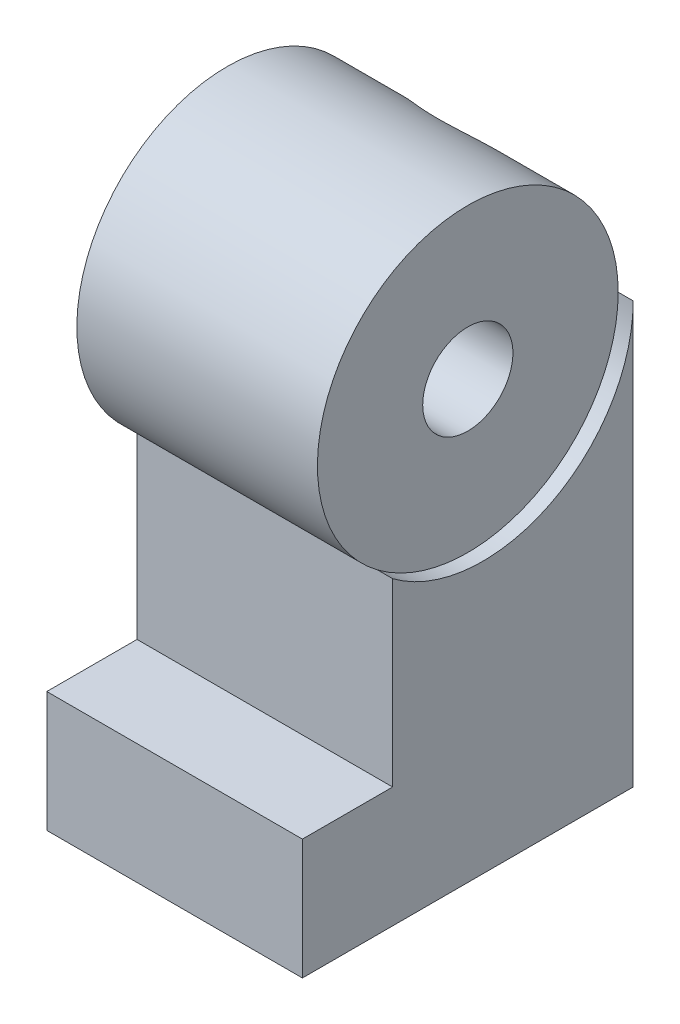
from build123d import *

# Parameters (mm, degrees)
BOSS_EXTRUDE4_DEPTH  = 6.746875
SKETCH6_R            = 3.96875
BOSS_EXTRUDE5_DEPTH  = 6.746875
SHELL2_T             = -0.79375
BOSS_EXTRUDE6_REACH  = 19.089
CUT_EXTRUDE2_START   = -0.396875
SKETCH11_R           = 3.96875
CUT_EXTRUDE2_DEPTH   = 0.396875
SKETCH13_R           = 3.96875
BOSS_EXTRUDE11_DEPTH = 6.35
SKETCH14_R           = 2.38125
CUT_EXTRUDE3_DEPTH   = 1.984375
CUT_EXTRUDE4_DEPTH   = 3.571875
SKETCH17_R           = 1.190625
CUT_EXTRUDE5_DEPTH   = 2.38125
SKETCH18_W           = 8.89
SKETCH18_H           = 15.24
CUT_EXTRUDE6_DEPTH   = 12.7


with BuildPart() as part:
    # Sketch2 → Boss-Extrude4 (new body)
    with BuildSketch(Plane(origin=(0, 0, 0), x_dir=(0, 0, -1), z_dir=(1, 0, 0))):
        Polygon((-4.365625, 0), (4.365625, 0), (4.365625, 11.1125), (-1.984375, 11.1125), (-1.984375, 3.175), (-4.365625, 3.175), align=None)
    extrude(amount=BOSS_EXTRUDE4_DEPTH)

    # Sketch6 → Boss-Extrude5 (add)
    with BuildSketch(Plane(origin=(6.746875, 0, 0), x_dir=(0, 0, -1), z_dir=(1, 0, 0))):
        with Locations((0.396875, 11.1125)):
            Circle(SKETCH6_R)
    extrude(amount=-BOSS_EXTRUDE5_DEPTH)

    # Shell2
    shell2_openings = [part.faces().sort_by_distance(p)[0] for p in [
        (3.3734375, 0, 0),
    ]]
    offset(amount=SHELL2_T, openings=shell2_openings, kind=Kind.INTERSECTION)

    # Sketch7 → Boss-Extrude6 (add, up to next)
    with BuildSketch(Plane.XZ, mode=Mode.PRIVATE) as boss_extrude6_sk1:
        Polygon((5.953125, 3.571875), (5.953125, 2.38125), (1.190625, 2.38125), (1.190625, -2.38125), (5.953125, -2.38125), (5.953125, -3.571875), (0.79375, -3.571875), (0.79375, 3.571875), align=None)
    boss_extrude6_tool1 = extrude(boss_extrude6_sk1.sketch, amount=-BOSS_EXTRUDE6_REACH, mode=Mode.PRIVATE) - part.part
    add(boss_extrude6_tool1.solids().sort_by_distance((5.865004, 0, 2.976562))[0])

    # Sketch11 → Cut-Extrude2 (cut)
    with BuildSketch(Plane.ZY.offset(CUT_EXTRUDE2_START)):
        with Locations((-0.396875, 11.1125)):
            Circle(SKETCH11_R)
    extrude(amount=CUT_EXTRUDE2_DEPTH, mode=Mode.SUBTRACT)

    # Sketch13 → Boss-Extrude11 (add)
    with BuildSketch(Plane(origin=(6.746875, 0, 0), x_dir=(0, 0, -1), z_dir=(1, 0, 0))):
        with Locations((0.396875, 11.1125)):
            Circle(SKETCH13_R)
    extrude(amount=-BOSS_EXTRUDE11_DEPTH)

    # Sketch14 → Cut-Extrude3 (cut)
    with BuildSketch(Plane(origin=(0, 0, -4.365625), x_dir=(-1, 0, 0), z_dir=(0, 0, -1))):
        with Locations(Location((-3.571875, 3.96875, 0), (0, 0, 90))):
            Circle(SKETCH14_R)
        with Locations(Location((-3.571875, 11.90625, 0), (0, 0, 340.528779366))):
            Circle(SKETCH14_R)
    extrude(amount=-CUT_EXTRUDE3_DEPTH, mode=Mode.SUBTRACT)

    # Sketch16 → Cut-Extrude4 (cut)
    with BuildSketch(Plane(origin=(0, 0, -2.38125), x_dir=(-1, 0, 0), z_dir=(0, 0, -1))):
        with BuildLine():
            Line((-2.778125, 9.66118597), (-2.778125, 14.15131403))
            ThreePointArc((-2.778125, 14.15131403), (-5.953125, 11.90625), (-2.778125, 9.66118597))
        make_face()
    extrude(amount=-CUT_EXTRUDE4_DEPTH, mode=Mode.SUBTRACT)

    # Sketch17 → Cut-Extrude5 (cut)
    with BuildSketch(Plane.ZY.offset(-0.396875)):
        with Locations((-0.396875, 11.1125)):
            Circle(SKETCH17_R)
    extrude(amount=-CUT_EXTRUDE5_DEPTH, mode=Mode.SUBTRACT)

    # Mirror6: part across plane


with BuildPart() as part_1:
    add(part.part)
    add(part.part.mirror(Plane(origin=(0, 0, 0), x_dir=(0, 0, 1), z_dir=(1, 0, 0))))

    # Sketch18 → Cut-Extrude6 (cut)
    with BuildSketch(Plane(origin=(0, 0, 0), x_dir=(0, 0, -1), z_dir=(1, 0, 0))):
        with Locations((0.079375, 7.62)):
            Rectangle(SKETCH18_W, SKETCH18_H)
    extrude(amount=CUT_EXTRUDE6_DEPTH, mode=Mode.SUBTRACT)


solid = part_1.part
